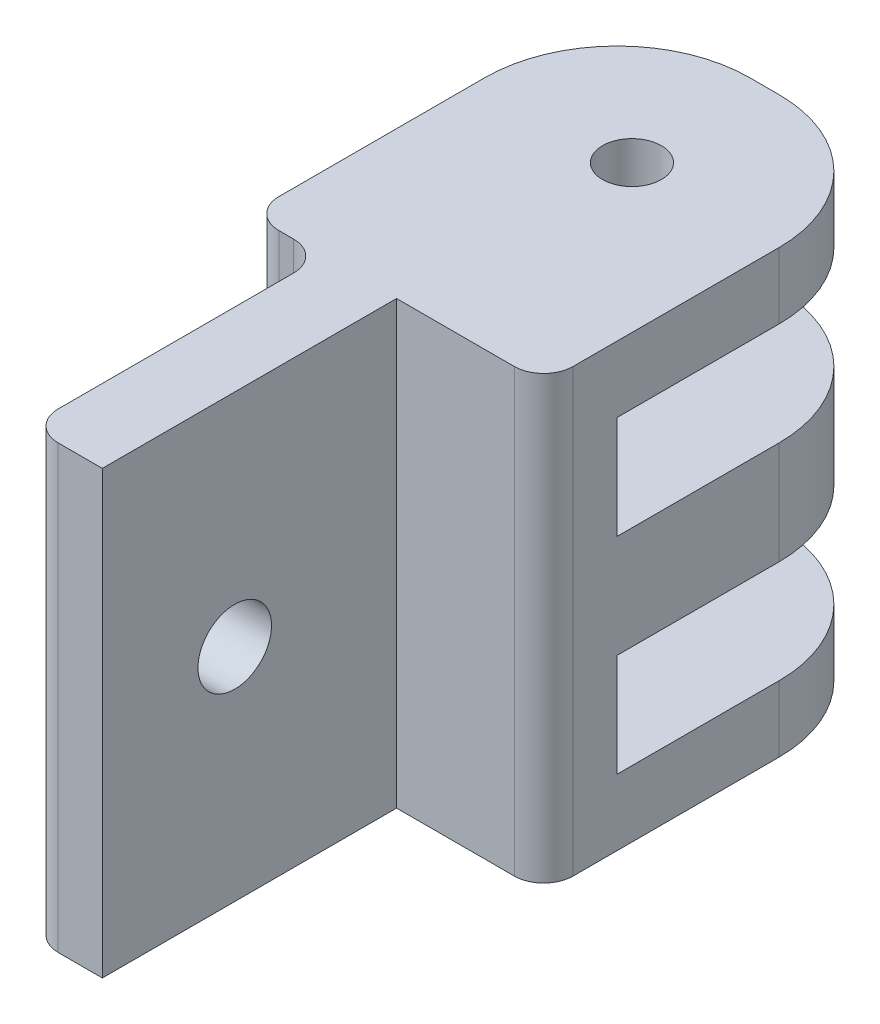
from build123d import *

# Parameters (mm, degrees)
SKETCH1_W               = 20
SKETCH1_H               = 30
BOSS_EXTRUDE1_DEPTH     = 25
SKETCH2_W               = 20
SKETCH2_H               = 7
SKETCH2_H_2             = 6.997545124
CUT_EXTRUDE1_DEPTH      = 20
SKETCH3_W               = 5
SKETCH3_H               = 30
BOSS_EXTRUDE3_DEPTH     = 20
CUT_EXTRUDE2_DEPTH      = 13
CUT_EXTRUDE2_DEPTH_BACK = 16
SKETCH5_R               = 2.5
FILLET1_R               = 9
CUT_EXTRUDE3_DEPTH      = 11
CUT_EXTRUDE3_DEPTH_BACK = 33
SKETCH6_R               = 2
FILLET2_R               = 2
FILLET3_R               = 2
FILLET4_R               = 2


with BuildPart() as part:
    # Sketch1 → Boss-Extrude1 (new body)
    with BuildSketch(Plane.XY):
        Rectangle(SKETCH1_W, SKETCH1_H)
    extrude(amount=BOSS_EXTRUDE1_DEPTH)

    # Sketch2 → Cut-Extrude1 (cut)
    with BuildSketch(Plane(origin=(0, 0, 0), x_dir=(-1, 0, 0), z_dir=(0, 0, -1))):
        with Locations((0, 7)):
            Rectangle(SKETCH2_W, SKETCH2_H)
        with Locations((0, -7.001227438)):
            Rectangle(SKETCH2_W, SKETCH2_H_2)
    extrude(amount=-CUT_EXTRUDE1_DEPTH, mode=Mode.SUBTRACT)

    # Sketch3 → Boss-Extrude3 (add)
    with BuildSketch(Plane.XY.offset(25)):
        with Locations((-2.5, 0)):
            Rectangle(SKETCH3_W, SKETCH3_H)
    extrude(amount=BOSS_EXTRUDE3_DEPTH)

    # Sketch5 → Cut-Extrude2 (cut, two sides: drawn at the far end of the back side and taken through both)
    with BuildSketch(Plane(origin=(0, 0, 0), x_dir=(0, 0, -1), z_dir=(1, 0, 0)).offset(-CUT_EXTRUDE2_DEPTH_BACK)):
        with Locations(Location((-36, 0, 0), (0, 0, 270))):
            Circle(SKETCH5_R)
    extrude(amount=CUT_EXTRUDE2_DEPTH + CUT_EXTRUDE2_DEPTH_BACK, mode=Mode.SUBTRACT)

    # Fillet1
    fillet1_edges = [part.edges().sort_by_distance(p)[0] for p in [
        (10, -0.001227438, 0),
        (10, 12.75, 0),
        (-10, -0.001227438, 0),
        (-10, -12.75, 0),
        (-10, 12.75, 0),
        (10, -12.75, 0),
    ]]
    fillet(fillet1_edges, radius=FILLET1_R)

    # Sketch6 → Cut-Extrude3 (cut, two sides: drawn at the far end of the back side and taken through both)
    with BuildSketch(Plane(origin=(0, 15, 0), x_dir=(1, 0, 0), z_dir=(0, 1, 0)).offset(-CUT_EXTRUDE3_DEPTH_BACK)):
        with Locations((0, -9)):
            Circle(SKETCH6_R)
    extrude(amount=CUT_EXTRUDE3_DEPTH + CUT_EXTRUDE3_DEPTH_BACK, mode=Mode.SUBTRACT)

    # Fillet2
    fillet2_edges = [part.edges().sort_by_distance(p)[0] for p in [
        (-10, 0, 25),
        (-5, 0, 25),
    ]]
    fillet(fillet2_edges, radius=FILLET2_R)

    # Fillet3
    fillet3_edges = [part.edges().sort_by_distance(p)[0] for p in [
        (10, 0, 25),
    ]]
    fillet(fillet3_edges, radius=FILLET3_R)

    # Fillet4
    fillet4_edges = [part.edges().sort_by_distance(p)[0] for p in [
        (-5, 0, 45),
    ]]
    fillet(fillet4_edges, radius=FILLET4_R)


solid = part.part
